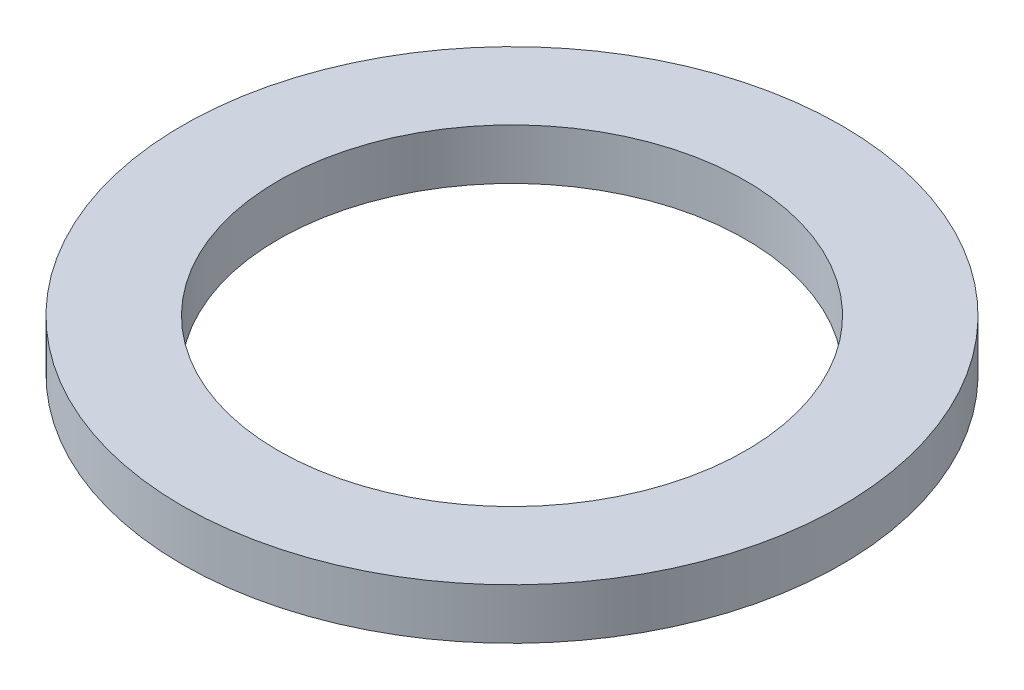
from build123d import *

# Parameters (mm, degrees)
SKETCH1_R           = 20.6375
SKETCH1_R_2         = 14.6375
BOSS_EXTRUDE1_DEPTH = 3.175


with BuildPart() as part:
    # Sketch1 → Boss-Extrude1 (new body)
    with BuildSketch(Plane(origin=(0, 0, 0), x_dir=(1, 0, 0), z_dir=(0, 1, 0))):
        with Locations(Location((0, 0, 0), (0, 0, 270))):
            Circle(SKETCH1_R)
        with Locations(Location((0, 0, 0), (0, 0, 270))):
            Circle(SKETCH1_R_2, mode=Mode.SUBTRACT)
    extrude(amount=BOSS_EXTRUDE1_DEPTH)


solid = part.part
